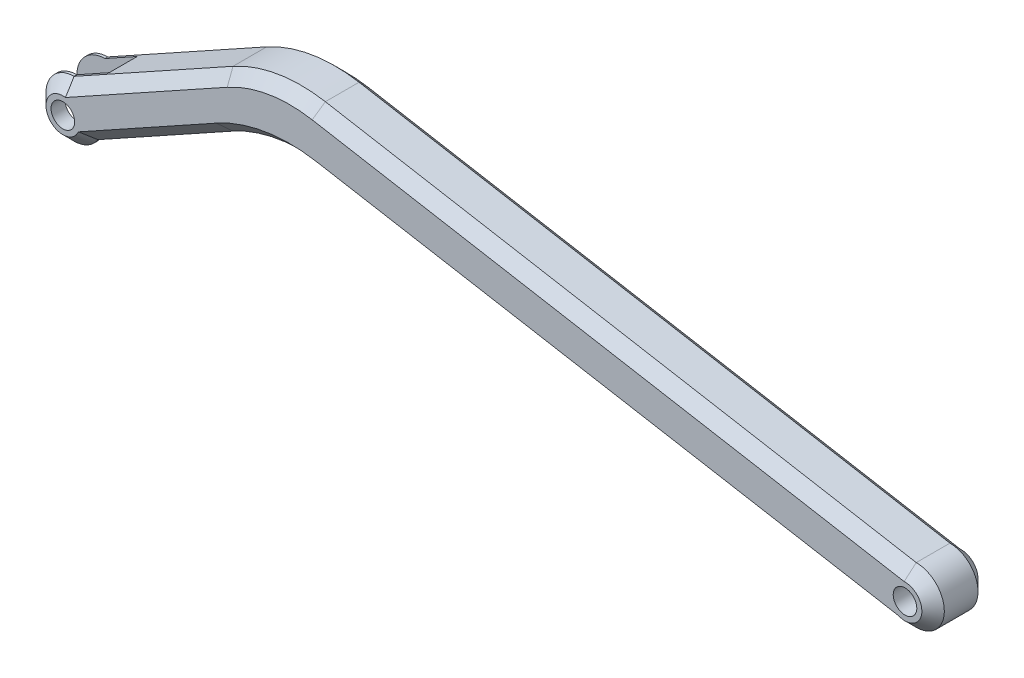
from build123d import *

# Parameters (mm, degrees)
BOSS_EXTRUDE2_DEPTH     = 5
CHAMFER2_SIZE           = 2
CUT_EXTRUDE2_DEPTH      = 4
CUT_EXTRUDE2_DEPTH_BACK = 14
SKETCH3_W               = 18
SKETCH3_H               = 5
SKETCH4_R               = 2.1
CUT_EXTRUDE3_DEPTH      = 85.075405536
CHAMFER3_SIZE           = 2


with BuildPart() as part:
    # Sketch1 → Boss-Extrude2 (new, symmetric)
    with BuildSketch(Plane.XY):
        with BuildLine():
            ThreePointArc((-75, 5), (-79.372054336, -2.425930931), (-70.757479261, -2.645943647))
            Line((-70.757479261, -2.645943647), (-46.692296896, 10.707154411))
            ThreePointArc((-46.692296896, 10.707154411), (-38.703947646, 13.501488579), (-30.241024495, 13.470522187))
            Line((-30.241024495, 13.470522187), (73.297376685, -4.701177921))
            ThreePointArc((73.297376685, -4.701177921), (79.924727891, -0.864323549), (75, 5))
            Line((75, 5), (-30.241024495, 23.470522187))
            ThreePointArc((-30.241024495, 23.470522187), (-38.703947646, 23.501488579), (-46.692296896, 20.707154411))
            Line((-46.692296896, 20.707154411), (-75, 5))
        make_face()
    extrude(amount=BOSS_EXTRUDE2_DEPTH, both=True)

    # Chamfer2
    chamfer2_edges = [part.edges().sort_by_distance(p)[0] for p in [
        (-79.372054336, -2.425930931, -5),
        (-60.846148448, 12.853577206, -5),
        (-38.703947646, 23.501488579, -5),
        (22.379487752, 14.235261094, -5),
        (79.924727891, -0.864323549, -5),
        (21.528176095, 4.384672133, -5),
        (-38.703947646, 13.501488579, -5),
        (-58.724888079, 4.030605382, -5),
    ]]
    chamfer(chamfer2_edges, length=CHAMFER2_SIZE)

    # Sketch3 → Cut-Extrude2 (cut, two sides: drawn at the far end of the back side and taken through both)
    with BuildSketch(Plane(origin=(-19.776683018, 35.641877363, 0), x_dir=(0.8744108672058327, 0.48518618623405146, 0), z_dir=(-0.48518618623405146, 0.8744108672058327, 0)).offset(-CUT_EXTRUDE2_DEPTH_BACK)):
        with Locations((-65.58081504, 0)):
            Rectangle(SKETCH3_W, SKETCH3_H)
    extrude(amount=CUT_EXTRUDE2_DEPTH + CUT_EXTRUDE2_DEPTH_BACK, mode=Mode.SUBTRACT)

    # Sketch4 → Cut-Extrude3 (cut, through all)
    with BuildSketch(Plane.XY.offset(5)):
        with Locations((-75, 0)):
            Circle(SKETCH4_R)
        with Locations((75, 0)):
            Circle(SKETCH4_R)
    extrude(amount=-CUT_EXTRUDE3_DEPTH, mode=Mode.SUBTRACT)

    # Chamfer3
    chamfer3_edges = [part.edges().sort_by_distance(p)[0] for p in [
        (79.924727891, -0.864323549, 5),
        (21.528176095, 4.384672133, 5),
        (-38.703947646, 13.501488579, 5),
        (-58.724888079, 4.030605382, 5),
        (-79.372054336, -2.425930931, 5),
        (-60.846148448, 12.853577206, 5),
        (-38.703947646, 23.501488579, 5),
        (22.379487752, 14.235261094, 5),
    ]]
    chamfer(chamfer3_edges, length=CHAMFER3_SIZE)


solid = part.part
